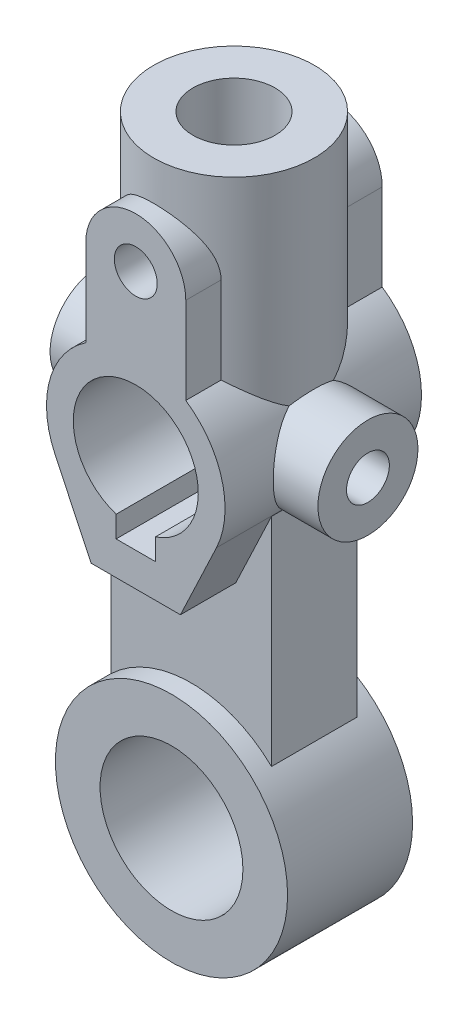
from build123d import *

# Parameters (mm, degrees)
BOSS_EXTRUDE1_DEPTH      = 27.5
SKETCH_FRONT_3_R         = 32.5
SKETCH_FRONT_3_R_2       = 20
BOSS_EXTRUDE2_DEPTH      = 17.5
BOSS_EXTRUDE3_REACH      = 136.42
BOSS_EXTRUDE3_END_RADIUS = 32.5
SKETCH_TOP_W             = 45
SKETCH_TOP_H             = 24
SKETCH_TOP_3_R           = 22.5
BOSS_EXTRUDE4_DEPTH      = 70
SKETCH_RIGHT_R           = 14
BOSS_EXTRUDE5_DEPTH      = 37.5
CUT_EXTRUDE1_DEPTH       = 136.715695529
CUT_EXTRUDE1_DEPTH_BACK  = 136.715695529
SKETCH_FRONT_4_R         = 6
CUT_EXTRUDE2_DEPTH       = 136.715695529
CUT_EXTRUDE2_DEPTH_BACK  = 136.715695529
SKETCH_RIGHT_3_R         = 6
SKETCH_TOP_4_R           = 11.5
CUT_EXTRUDE3_DEPTH       = 136.715695529


with BuildPart() as part:
    # Sketch_Front → Boss-Extrude1 (new, symmetric)
    with BuildSketch(Plane.XY):
        with BuildLine():
            Line((14, 20.712315177), (14, 45))
            ThreePointArc((14, 45), (0, 59), (-14, 45))
            Line((-14, 45), (-14, 20.712315177))
            ThreePointArc((-14, 20.712315177), (-24.114680724, 6.594101422), (-22.59139561, -10.70648609))
            Line((-22.59139561, -10.70648609), (-12.5, -32))
            Line((-12.5, -32), (12.5, -32))
            Line((12.5, -32), (22.59139561, -10.70648609))
            ThreePointArc((22.59139561, -10.70648609), (24.114680724, 6.594101422), (14, 20.712315177))
        make_face()
    extrude(amount=BOSS_EXTRUDE1_DEPTH, both=True)



with BuildPart() as body_2:
    # Sketch_Front<3> → Boss-Extrude2 (new, symmetric)
    with BuildSketch(Plane.XY):
        with Locations((0, -95)):
            Circle(SKETCH_FRONT_3_R)
        with Locations((0, -95)):
            Circle(SKETCH_FRONT_3_R_2, mode=Mode.SUBTRACT)
    extrude(amount=BOSS_EXTRUDE2_DEPTH, both=True)


with BuildPart() as part_1:
    add(part.part)

    add(body_2.part)  # Boss-Extrude3 merges body 2
    # Boss-Extrude3: up to this cylinder (the profile starts outside it)
    boss_extrude3_end = Plane(origin=(0, -95, 0), z_dir=(0, 0, -1)) * Cylinder(BOSS_EXTRUDE3_END_RADIUS, 338.84, mode=Mode.PRIVATE)
    # Sketch_Top → Boss-Extrude3 (add, up to the surface)
    with BuildSketch(Plane(origin=(0, 0, 0), x_dir=(1, 0, 0), z_dir=(0, 1, 0)), mode=Mode.PRIVATE) as boss_extrude3_sk1:
        Rectangle(SKETCH_TOP_W, SKETCH_TOP_H)
    boss_extrude3_tool1 = extrude(boss_extrude3_sk1.sketch, amount=-BOSS_EXTRUDE3_REACH, mode=Mode.PRIVATE) - boss_extrude3_end
    add(boss_extrude3_tool1.solids().sort_by_distance((0, 0, 0))[0])

    # Sketch_Top<3> → Boss-Extrude4 (add)
    with BuildSketch(Plane(origin=(0, 0, 0), x_dir=(1, 0, 0), z_dir=(0, 1, 0))):
        Circle(SKETCH_TOP_3_R)
    extrude(amount=BOSS_EXTRUDE4_DEPTH)

    # Sketch_Right → Boss-Extrude5 (add, symmetric)
    with BuildSketch(Plane(origin=(0, 0, 0), x_dir=(0, 0, -1), z_dir=(1, 0, 0))):
        Circle(SKETCH_RIGHT_R)
    extrude(amount=BOSS_EXTRUDE5_DEPTH, both=True)

    # Sketch_Front<4> → Cut-Extrude1 (cut, two sides: drawn at the far end of the back side and taken through both)
    with BuildSketch(Plane.XY.offset(-CUT_EXTRUDE1_DEPTH_BACK)):
        with BuildLine():
            Line((-5.5, -16.613247726), (-5.5, -22.613247726))
            Line((-5.5, -22.613247726), (5.5, -22.613247726))
            Line((5.5, -22.613247726), (5.5, -16.613247726))
            ThreePointArc((5.5, -16.613247726), (0, 17.5), (-5.5, -16.613247726))
        make_face()
        with Locations((0, 45)):
            Circle(SKETCH_FRONT_4_R)
    extrude(amount=CUT_EXTRUDE1_DEPTH + CUT_EXTRUDE1_DEPTH_BACK, mode=Mode.SUBTRACT)

    # Sketch_Right<3> → Cut-Extrude2 (cut, two sides: drawn at the far end of the back side and taken through both)
    with BuildSketch(Plane(origin=(0, 0, 0), x_dir=(0, 0, -1), z_dir=(1, 0, 0)).offset(-CUT_EXTRUDE2_DEPTH_BACK)):
        Circle(SKETCH_RIGHT_3_R)
    extrude(amount=CUT_EXTRUDE2_DEPTH + CUT_EXTRUDE2_DEPTH_BACK, mode=Mode.SUBTRACT)

    # Sketch_Top<4> → Cut-Extrude3 (cut, through all)
    with BuildSketch(Plane(origin=(0, 0, 0), x_dir=(1, 0, 0), z_dir=(0, 1, 0))):
        Circle(SKETCH_TOP_4_R)
    extrude(amount=CUT_EXTRUDE3_DEPTH, mode=Mode.SUBTRACT)


solid = part_1.part
